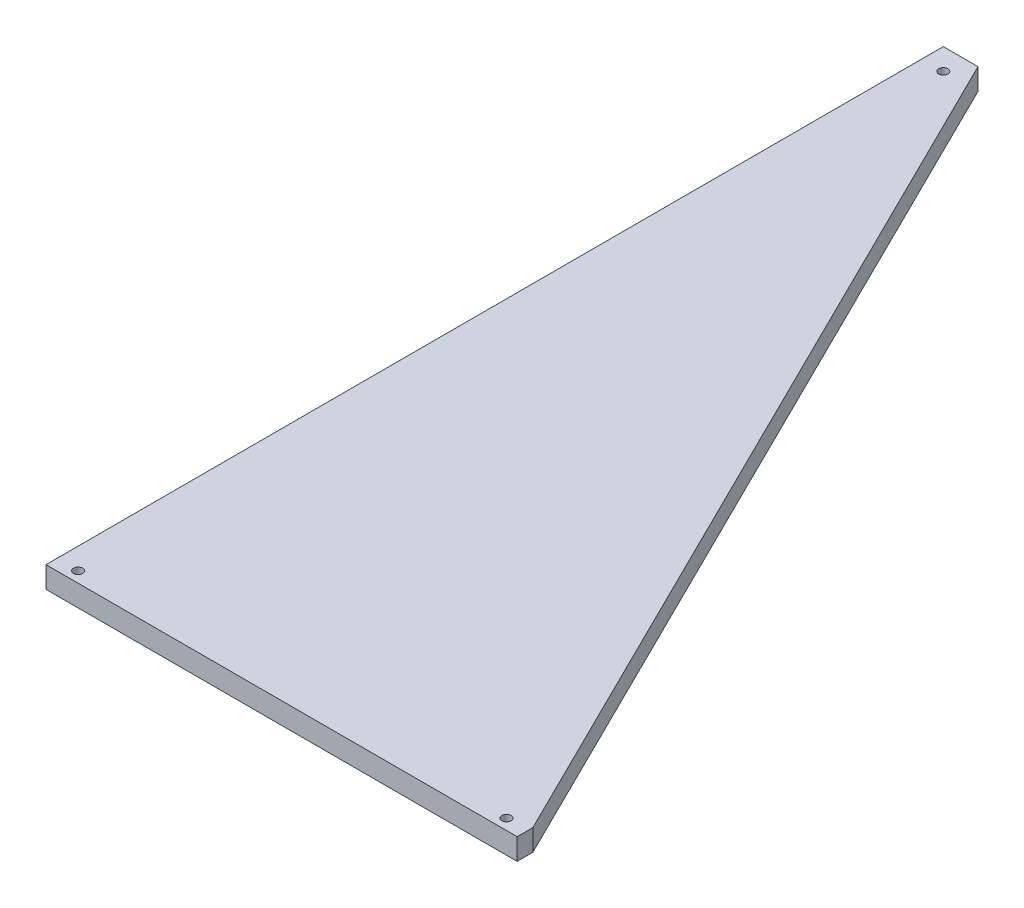
from build123d import *

# Parameters (mm, degrees)
SKETCH1_R           = 2.15
BOSS_EXTRUDE1_DEPTH = 10


with BuildPart() as part:
    # Sketch1 → Boss-Extrude1 (new body)
    with BuildSketch(Plane(origin=(0, 0, 0), x_dir=(1, 0, 0), z_dir=(0, 1, 0))):
        Polygon((-10, 413.994584246), (-10, -5), (210, -5), (210, 2.339770788), (6.207756484, 413.994584246), align=None)
        with Locations(Location((0, 403.994584246, 0), (0, 0, 270))):
            Circle(SKETCH1_R, mode=Mode.SUBTRACT)
        with Locations(Location((0, 0, 0), (0, 0, 270))):
            Circle(SKETCH1_R, mode=Mode.SUBTRACT)
        with Locations(Location((200, 0, 0), (0, 0, 270))):
            Circle(SKETCH1_R, mode=Mode.SUBTRACT)
    extrude(amount=BOSS_EXTRUDE1_DEPTH)


solid = part.part
